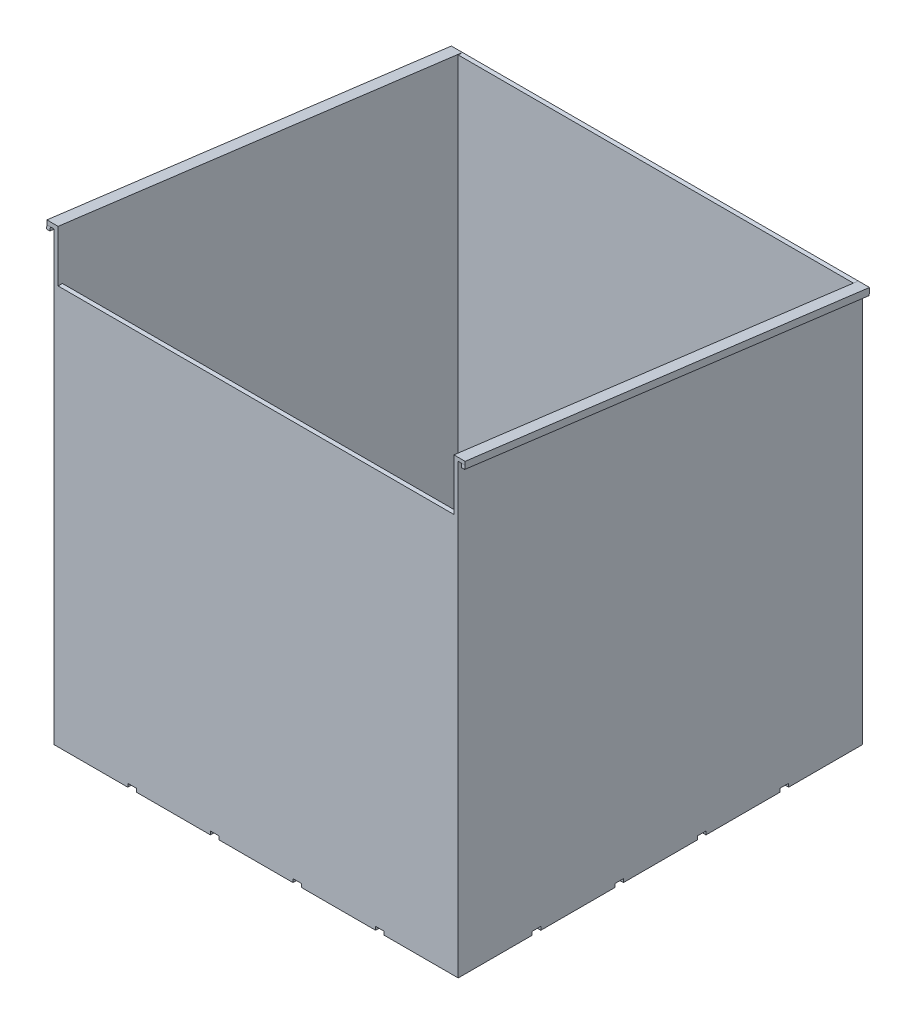
from build123d import *

# Parameters (mm, degrees)
SKETCH1_W            = 235
SKETCH1_H            = 235
SKETCH1_W_2          = 230
SKETCH1_H_2          = 230
EXTRUDE_THIN1_DEPTH  = 230
BOSS_EXTRUDE1_DEPTH  = 2.5
BOSS_EXTRUDE2_DEPTH  = 2.5
BOSS_EXTRUDE5_DEPTH  = 4
SKETCH8_W            = 2
SKETCH8_H            = 236.907154809
BOSS_EXTRUDE6_DEPTH  = 2
BOSS_EXTRUDE7_DEPTH  = 4
SKETCH10_W           = 2
SKETCH10_H           = 236.90715481
BOSS_EXTRUDE8_DEPTH  = 2
SKETCH11_W           = 2
SKETCH11_H           = 2
BOSS_EXTRUDE9_DEPTH  = 2
SKETCH12_W           = 2
SKETCH12_H           = 2
BOSS_EXTRUDE10_DEPTH = 2
BOSS_EXTRUDE11_DEPTH = 2


with BuildPart() as part:
    # Sketch1 → Extrude-Thin1 (new body)
    with BuildSketch(Plane(origin=(0, 0, 0), x_dir=(1, 0, 0), z_dir=(0, 1, 0))):
        with Locations((115, 115)):
            Rectangle(SKETCH1_W, SKETCH1_H)
        with Locations((115, 115)):
            Rectangle(SKETCH1_W_2, SKETCH1_H_2, mode=Mode.SUBTRACT)
    extrude(amount=EXTRUDE_THIN1_DEPTH)

    # Sketch4 → Boss-Extrude1 (add)
    with BuildSketch(Plane(origin=(232.5, 0, 0), x_dir=(0, 0, -1), z_dir=(1, 0, 0))):
        Polygon((-2.5, 230), (-2.5, 260), (232.5, 230), align=None)
    extrude(amount=-BOSS_EXTRUDE1_DEPTH)

    # Sketch5 → Boss-Extrude2 (add)
    with BuildSketch(Plane.ZY.offset(2.5)):
        Polygon((-232.5, 230), (2.5, 230), (2.5, 260), align=None)
    extrude(amount=-BOSS_EXTRUDE2_DEPTH)

    # Sketch6 → Boss-Extrude5 (add)
    with BuildSketch(Plane.ZY.offset(2.5)):
        Polygon((-232.5, 230), (2.5, 260), (2.5, 257.5), (-232.5, 227.5), align=None)
    extrude(amount=BOSS_EXTRUDE5_DEPTH)

    # Sketch8 → Boss-Extrude6 (add)
    with BuildSketch(Plane(origin=(0, 253.056792873, -32.305122494), x_dir=(1, 0, 0), z_dir=(0, -0.9919497796038491, 0.12663188675793835))):
        with Locations((-5.5, -83.365992116)):
            Rectangle(SKETCH8_W, SKETCH8_H)
    extrude(amount=BOSS_EXTRUDE6_DEPTH)

    # Sketch9 → Boss-Extrude7 (add)
    with BuildSketch(Plane(origin=(232.5, 0, 0), x_dir=(0, 0, -1), z_dir=(1, 0, 0))):
        Polygon((-2.5, 260), (232.5, 230), (232.5, 228), (-2.5, 258), align=None)
    extrude(amount=BOSS_EXTRUDE7_DEPTH)

    # Sketch10 → Boss-Extrude8 (add)
    with BuildSketch(Plane(origin=(0, 253.548775056, -32.367928731), x_dir=(1, 0, 0), z_dir=(0, -0.9919497796038491, 0.12663188675793827))):
        with Locations((235.5, -83.302676172)):
            Rectangle(SKETCH10_W, SKETCH10_H)
    extrude(amount=BOSS_EXTRUDE8_DEPTH)

    # Sketch11 → Boss-Extrude9 (add)
    with BuildSketch(Plane(origin=(0, 253.548775056, -32.367928731), x_dir=(1, 0, 0), z_dir=(0, -0.9919497796038491, 0.12663188675793827))):
        with Locations((233.5, -200.756253577)):
            Rectangle(SKETCH11_W, SKETCH11_H)
    extrude(amount=BOSS_EXTRUDE9_DEPTH)

    # Sketch12 → Boss-Extrude10 (add)
    with BuildSketch(Plane(origin=(0, 253.056792873, -32.305122494), x_dir=(1, 0, 0), z_dir=(0, -0.9919497796038491, 0.12663188675793835))):
        with Locations((-3.5, -200.81956952)):
            Rectangle(SKETCH12_W, SKETCH12_H)
    extrude(amount=BOSS_EXTRUDE10_DEPTH)

    # Sketch13 → Boss-Extrude11 (add)
    with BuildSketch(Plane.XZ):
        Polygon((-2.5, 2.5), (40.5, 2.5), (40.5, -4.341126342), (45.5, -4.341126342), (45.5, 2.5), (88.5, 2.5), (88.5, -4.341126342), (93.5, -4.341126342), (93.5, 2.5), (136.5, 2.5), (136.5, -4.341126342), (141.5, -4.341126342), (141.5, 2.5), (184.5, 2.5), (184.5, -4.341126342), (189.5, -4.341126342), (189.5, 2.5), (232.5, 2.5), (232.5, -40.5), (225.658873658, -40.5), (225.658873658, -45.5), (232.5, -45.5), (232.5, -88.5), (225.658873658, -88.5), (225.658873658, -93.5), (232.5, -93.5), (232.5, -136.5), (225.658873658, -136.5), (225.658873658, -141.5), (232.5, -141.5), (232.5, -184.5), (225.658873658, -184.5), (225.658873658, -189.5), (232.5, -189.5), (232.5, -232.5), (189.5, -232.5), (189.5, -225.658873658), (184.5, -225.658873658), (184.5, -232.5), (141.5, -232.5), (141.5, -225.658873658), (136.5, -225.658873658), (136.5, -232.5), (93.5, -232.5), (93.5, -225.658873658), (88.5, -225.658873658), (88.5, -232.5), (45.5, -232.5), (45.5, -225.658873658), (40.5, -225.658873658), (40.5, -232.5), (-2.5, -232.5), (-2.5, -189.5), (4.341126342, -189.5), (4.341126342, -184.5), (-2.5, -184.5), (-2.5, -141.5), (4.341126342, -141.5), (4.341126342, -136.5), (-2.5, -136.5), (-2.5, -93.5), (4.341126342, -93.5), (4.341126342, -88.5), (-2.5, -88.5), (-2.5, -45.5), (4.341126342, -45.5), (4.341126342, -40.5), (-2.5, -40.5), align=None)
    extrude(amount=BOSS_EXTRUDE11_DEPTH)


solid = part.part
